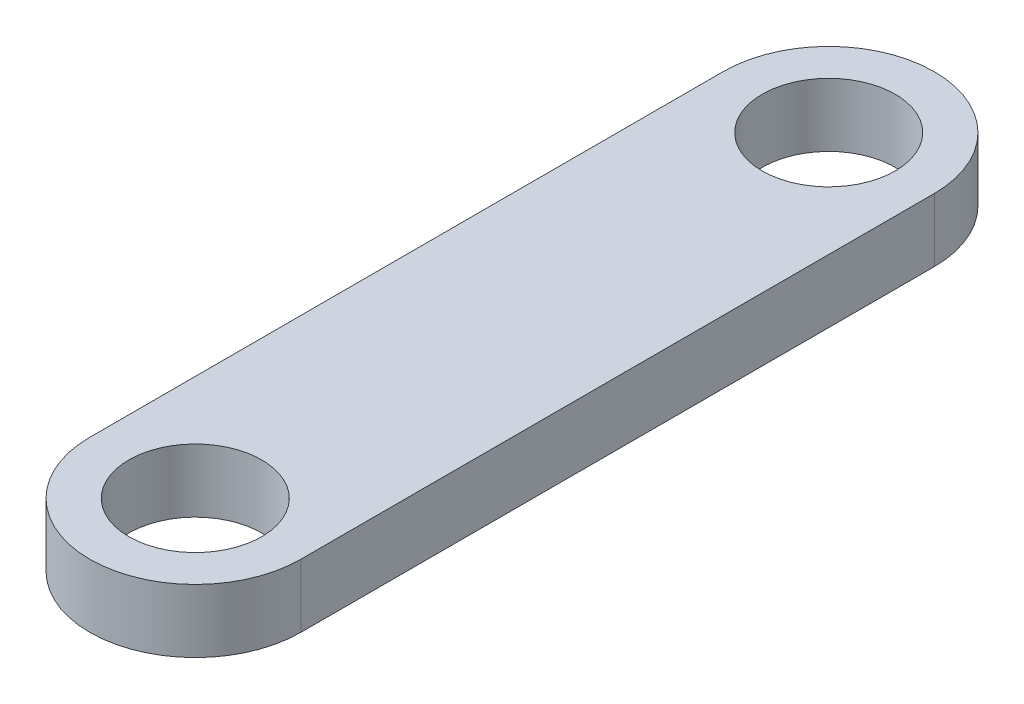
from build123d import *

# Parameters (mm, degrees)
SKETCH1_R           = 2
BOSS_EXTRUDE1_DEPTH = 1.905


with BuildPart() as part:
    # Sketch1 → Boss-Extrude1 (new body)
    with BuildSketch(Plane(origin=(0, 0, 0), x_dir=(1, 0, 0), z_dir=(0, 1, 0))):
        with BuildLine():
            Line((3.175, -19.05), (3.175, 0))
            ThreePointArc((3.175, 0), (0, 3.175), (-3.175, 0))
            Line((-3.175, 0), (-3.175, -19.05))
            ThreePointArc((-3.175, -19.05), (0, -22.225), (3.175, -19.05))
        make_face()
        with Locations(Location((0, 0, 0), (0, 0, 270))):
            Circle(SKETCH1_R, mode=Mode.SUBTRACT)
        with Locations(Location((0, -19.05, 0), (0, 0, 270))):
            Circle(SKETCH1_R, mode=Mode.SUBTRACT)
    extrude(amount=-BOSS_EXTRUDE1_DEPTH)


solid = part.part
